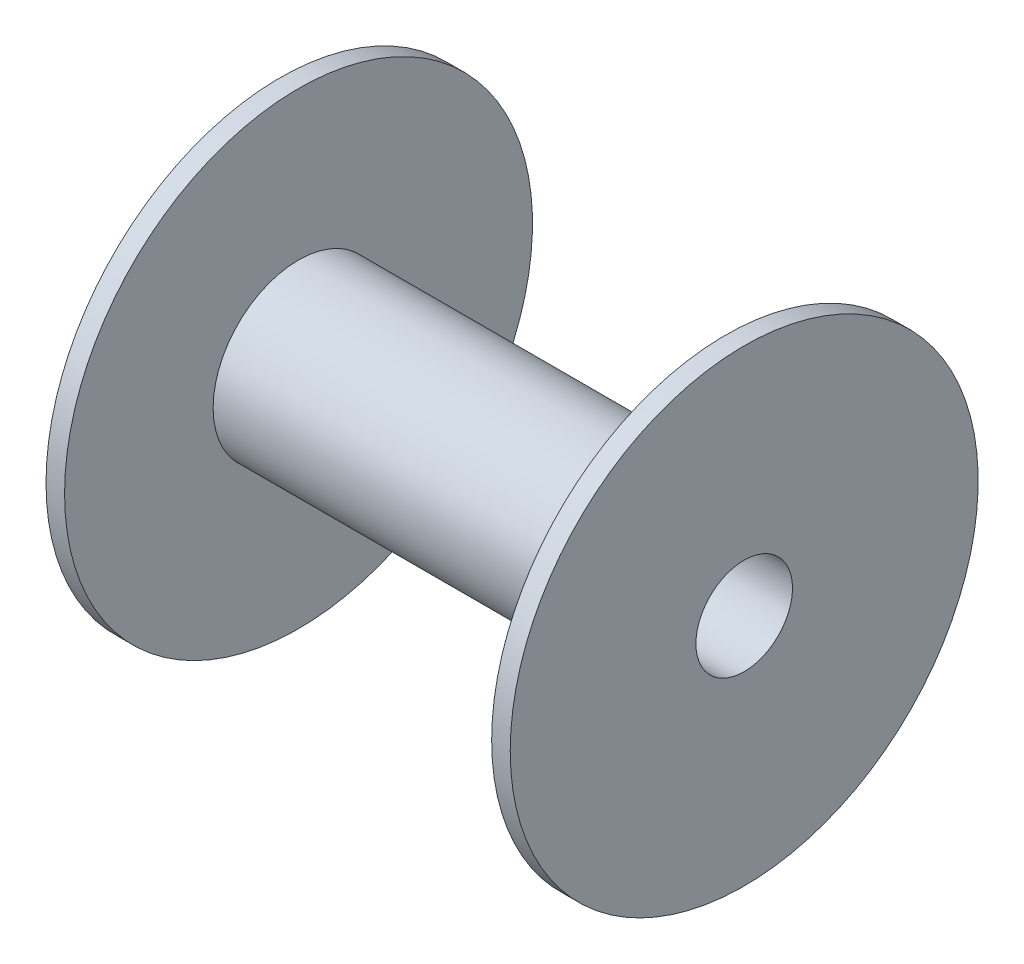
from build123d import *


with BuildPart() as part:
    # Sketch1 → Revolve1 (revolve)
    with BuildSketch(Plane.XY, mode=Mode.PRIVATE) as revolve1_sk:
        Polygon((-62.5, 63), (-57.5, 63), (-57.5, 23), (57.5, 23), (57.5, 63), (62.5, 63), (62.5, 13), (-62.5, 13), align=None)
    revolve(revolve1_sk.sketch.rotate(Axis((-75, 0, 0), (1, 0, 0)), 90), axis=Axis((-75, 0, 0), (1, 0, 0)))


solid = part.part
